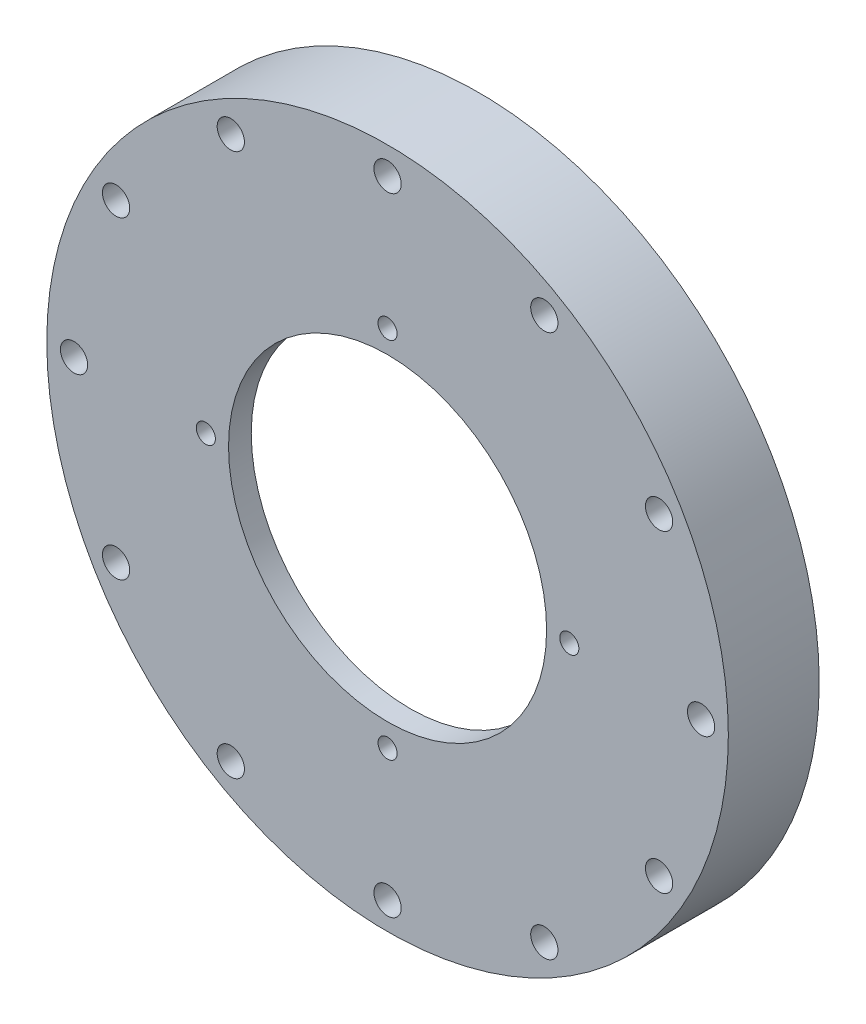
from build123d import *

# Parameters (mm, degrees)
SKETCH_1_R          = 75
SKETCH_1_R_2        = 35
SKETCH_1_R_3        = 3
EXTRUDE_1_DEPTH     = 20
SKETCH_2_R          = 60
CUT_EXTRUDE_1_DEPTH = 15
HOLE_WIZARD_M5_2_D  = 4.2


with BuildPart() as part:
    # 草图1 → 凸台-拉伸1 (new body)
    with BuildSketch(Plane.XY):
        Circle(SKETCH_1_R)
        Circle(SKETCH_1_R_2, mode=Mode.SUBTRACT)
        with Locations((-69, 0)):
            Circle(SKETCH_1_R_3, mode=Mode.SUBTRACT)
        with Locations((-59.755752861, 34.5)):
            Circle(SKETCH_1_R_3, mode=Mode.SUBTRACT)
        with Locations((-34.5, 59.755752861)):
            Circle(SKETCH_1_R_3, mode=Mode.SUBTRACT)
        with Locations((0, 69)):
            Circle(SKETCH_1_R_3, mode=Mode.SUBTRACT)
        with Locations((34.5, 59.755752861)):
            Circle(SKETCH_1_R_3, mode=Mode.SUBTRACT)
        with Locations((59.755752861, 34.5)):
            Circle(SKETCH_1_R_3, mode=Mode.SUBTRACT)
        with Locations((69, 0)):
            Circle(SKETCH_1_R_3, mode=Mode.SUBTRACT)
        with Locations((59.755752861, -34.5)):
            Circle(SKETCH_1_R_3, mode=Mode.SUBTRACT)
        with Locations((34.5, -59.755752861)):
            Circle(SKETCH_1_R_3, mode=Mode.SUBTRACT)
        with Locations((0, -69)):
            Circle(SKETCH_1_R_3, mode=Mode.SUBTRACT)
        with Locations((-34.5, -59.755752861)):
            Circle(SKETCH_1_R_3, mode=Mode.SUBTRACT)
        with Locations((-59.755752861, -34.5)):
            Circle(SKETCH_1_R_3, mode=Mode.SUBTRACT)
    extrude(amount=EXTRUDE_1_DEPTH)

    # 草图2 → 切除-拉伸1 (cut)
    with BuildSketch(Plane.XY):
        Circle(SKETCH_2_R)
    extrude(amount=CUT_EXTRUDE_1_DEPTH, mode=Mode.SUBTRACT)

    # M5 螺纹孔的螺纹孔钻头2 (through all)
    with Locations(Plane.XY.offset(20)):
        with Locations((0, 40), (40, 0), (0, -40), (-40, 0)):
            Hole(HOLE_WIZARD_M5_2_D / 2)


solid = part.part
